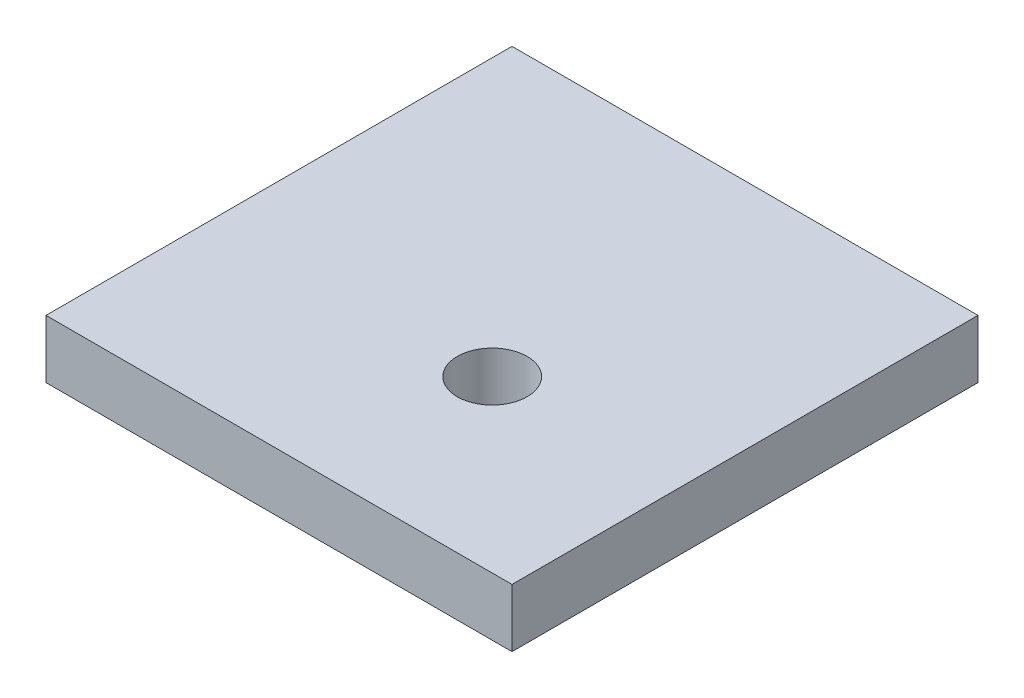
from build123d import *

# Parameters (mm, degrees)
SKETCH2_W           = 400
SKETCH2_H           = 50
BOSS_EXTRUDE1_DEPTH = 400
SKETCH3_R           = 30
CUT_EXTRUDE1_DEPTH  = 451


with BuildPart() as part:
    # Sketch2 → Boss-Extrude1 (new body)
    with BuildSketch(Plane.XY):
        Rectangle(SKETCH2_W, SKETCH2_H)
    extrude(amount=BOSS_EXTRUDE1_DEPTH)

    # Sketch3 → Cut-Extrude1 (cut, through all)
    with BuildSketch(Plane(origin=(0, 25, 0), x_dir=(1, 0, 0), z_dir=(0, 1, 0))):
        with Locations(Location((37, -254, 0), (0, 0, 270))):
            Circle(SKETCH3_R)
    extrude(amount=-CUT_EXTRUDE1_DEPTH, mode=Mode.SUBTRACT)


solid = part.part
